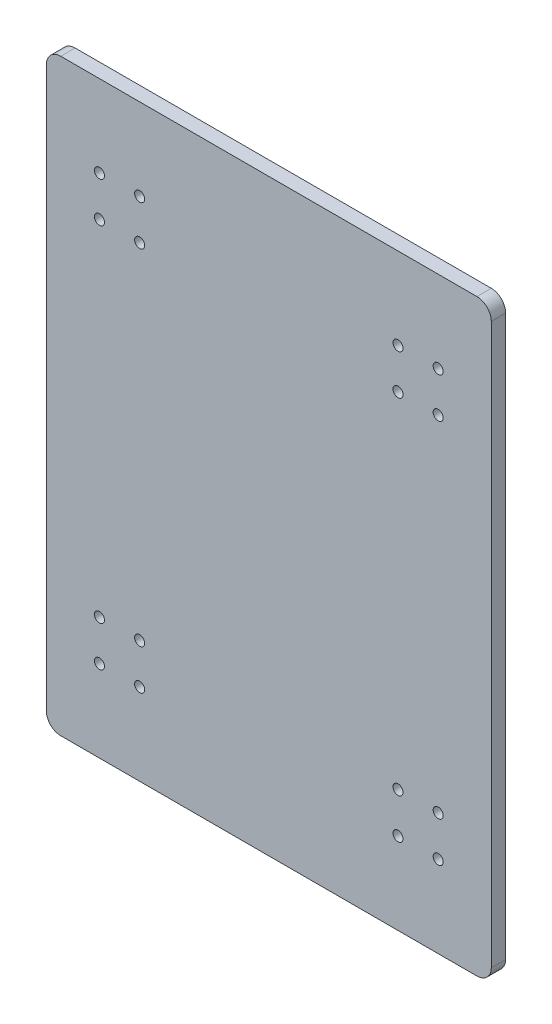
from build123d import *

# Parameters (mm, degrees)
SKETCH_1_W               = 155
SKETCH_1_H               = 205
EXTRUDE_1_DEPTH          = 5
SKETCH_2_R               = 1.75
CUT_EXTRUDE_1_DEPTH      = 129.598211496
MIRROR_2_COPY_1_SKETCH_R = 1.75
MIRROR_2_COPY_1_DEPTH    = 129.598211496
FILLET_1_R               = 5


with BuildPart() as part:
    # ｽｹｯﾁ1 → ﾎﾞｽ - 押し出し1 (new body)
    with BuildSketch(Plane.XY):
        Rectangle(SKETCH_1_W, SKETCH_1_H)
    extrude(amount=EXTRUDE_1_DEPTH)

    # ｽｹｯﾁ2 → ｶｯﾄ - 押し出し1 (cut, through all)
    with BuildSketch(Plane.XY.offset(5)):
        with Locations((45, 74)):
            Circle(SKETCH_2_R)
        with Locations((59, 74)):
            Circle(SKETCH_2_R)
        with Locations((45, 60)):
            Circle(SKETCH_2_R)
        with Locations((59, 60)):
            Circle(SKETCH_2_R)
    cut_extrude_1 = extrude(amount=-CUT_EXTRUDE_1_DEPTH, mode=Mode.SUBTRACT)

    # ﾐﾗｰ1: ｶｯﾄ - 押し出し1 across plane
    add(cut_extrude_1.mirror(Plane.ZX), mode=Mode.SUBTRACT)

    # ﾐﾗｰ2: ｶｯﾄ - 押し出し1 across plane
    add(cut_extrude_1.mirror(Plane(origin=(0, 0, 0), x_dir=(0, 0, 1), z_dir=(1, 0, 0))), mode=Mode.SUBTRACT)

    # ﾐﾗｰ2 copy 1 sketch → ﾐﾗｰ2 copy 1 (cut, through all)
    with BuildSketch(Plane(origin=(0, 0, 5), x_dir=(-1, 0, 0), z_dir=(0, 0, 1))):
        with Locations((45, 74)):
            Circle(MIRROR_2_COPY_1_SKETCH_R)
        with Locations((59, 74)):
            Circle(MIRROR_2_COPY_1_SKETCH_R)
        with Locations((45, 60)):
            Circle(MIRROR_2_COPY_1_SKETCH_R)
        with Locations((59, 60)):
            Circle(MIRROR_2_COPY_1_SKETCH_R)
    extrude(amount=-MIRROR_2_COPY_1_DEPTH, mode=Mode.SUBTRACT)

    # ﾌｨﾚｯﾄ1
    fillet_1_edges = [part.edges().sort_by_distance(p)[0] for p in [
        (77.5, -102.5, 2.5),
        (-77.5, -102.5, 2.5),
        (-77.5, 102.5, 2.5),
        (77.5, 102.5, 2.5),
    ]]
    fillet(fillet_1_edges, radius=FILLET_1_R)


solid = part.part
